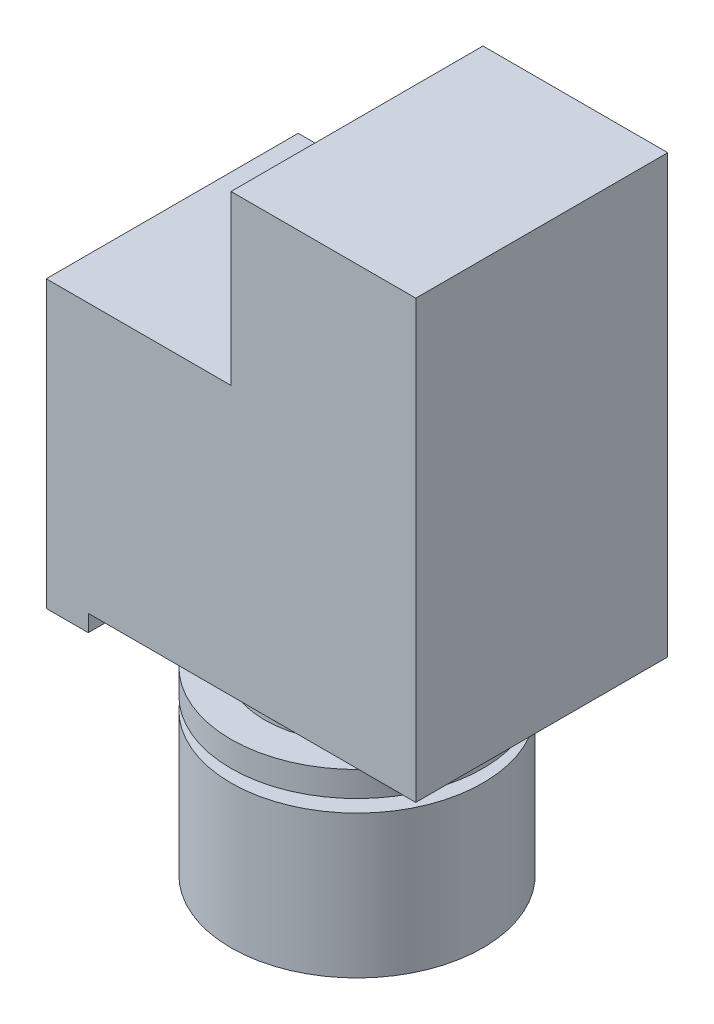
from build123d import *

# Parameters (mm, degrees)
SKETCH_1_R          = 15
EXTRUDE_1_DEPTH     = 17
SKETCH_2_R          = 11
EXTRUDE_2_DEPTH     = 1.5
SKETCH_3_R          = 15
EXTRUDE_3_DEPTH     = 3
SKETCH_4_R          = 11
EXTRUDE_4_DEPTH     = 4.5
SKETCH_6_W          = 44
SKETCH_6_H          = 30
EXTRUDE_6_DEPTH     = 52
SKETCH_7_W          = 5
SKETCH_7_H          = 30
EXTRUDE_7_DEPTH     = 2
SKETCH_8_W          = 22
SKETCH_8_H          = 20
CUT_EXTRUDE_1_DEPTH = 87.417590802
SKETCH_9_R          = 13
SKETCH_9_R_2        = 12
CUT_EXTRUDE_2_DEPTH = 2


with BuildPart() as part:
    # 草圖1 → 伸長1 (new body)
    with BuildSketch(Plane(origin=(0, 0, 0), x_dir=(1, 0, 0), z_dir=(0, 1, 0))):
        with Locations(Location((0, 0, 0), (0, 0, 270))):
            Circle(SKETCH_1_R)
    extrude(amount=EXTRUDE_1_DEPTH)

    # 草圖2 → 伸長2 (add)
    with BuildSketch(Plane(origin=(0, 17, 0), x_dir=(1, 0, 0), z_dir=(0, 1, 0))):
        with Locations(Location((0, 0, 0), (0, 0, 270))):
            Circle(SKETCH_2_R)
    extrude(amount=EXTRUDE_2_DEPTH)

    # 草圖3 → 伸長3 (add)
    with BuildSketch(Plane(origin=(0, 18.5, 0), x_dir=(1, 0, 0), z_dir=(0, 1, 0))):
        with Locations(Location((0, 0, 0), (0, 0, 270))):
            Circle(SKETCH_3_R)
    extrude(amount=EXTRUDE_3_DEPTH)

    # 草圖4 → 伸長4 (add)
    with BuildSketch(Plane(origin=(0, 21.5, 0), x_dir=(1, 0, 0), z_dir=(0, 1, 0))):
        with Locations(Location((0, 0, 0), (0, 0, 270))):
            Circle(SKETCH_4_R)
    extrude(amount=EXTRUDE_4_DEPTH)

    # 草圖6 → 伸長6 (add)
    with BuildSketch(Plane(origin=(0, 26, 0), x_dir=(1, 0, 0), z_dir=(0, 1, 0))):
        Rectangle(SKETCH_6_W, SKETCH_6_H)
    extrude(amount=EXTRUDE_6_DEPTH)

    # 草圖7 → 伸長7 (add)
    with BuildSketch(Plane.XZ.offset(-26)):
        with Locations((-19.5, 0)):
            Rectangle(SKETCH_7_W, SKETCH_7_H)
    extrude(amount=EXTRUDE_7_DEPTH)

    # 草圖8 → 除料-伸長1 (cut, through all)
    with BuildSketch(Plane(origin=(0, 0, -15), x_dir=(-1, 0, 0), z_dir=(0, 0, -1))):
        with Locations((11, 68)):
            Rectangle(SKETCH_8_W, SKETCH_8_H)
    extrude(amount=-CUT_EXTRUDE_1_DEPTH, mode=Mode.SUBTRACT)

    # 草圖9 → 除料-伸長2 (cut)
    with BuildSketch(Plane.XZ):
        with Locations(Location((0, 0, 0), (0, 0, 270))):
            Circle(SKETCH_9_R)
        with Locations(Location((0, 0, 0), (0, 0, 270))):
            Circle(SKETCH_9_R_2, mode=Mode.SUBTRACT)
    extrude(amount=-CUT_EXTRUDE_2_DEPTH, mode=Mode.SUBTRACT)


solid = part.part
